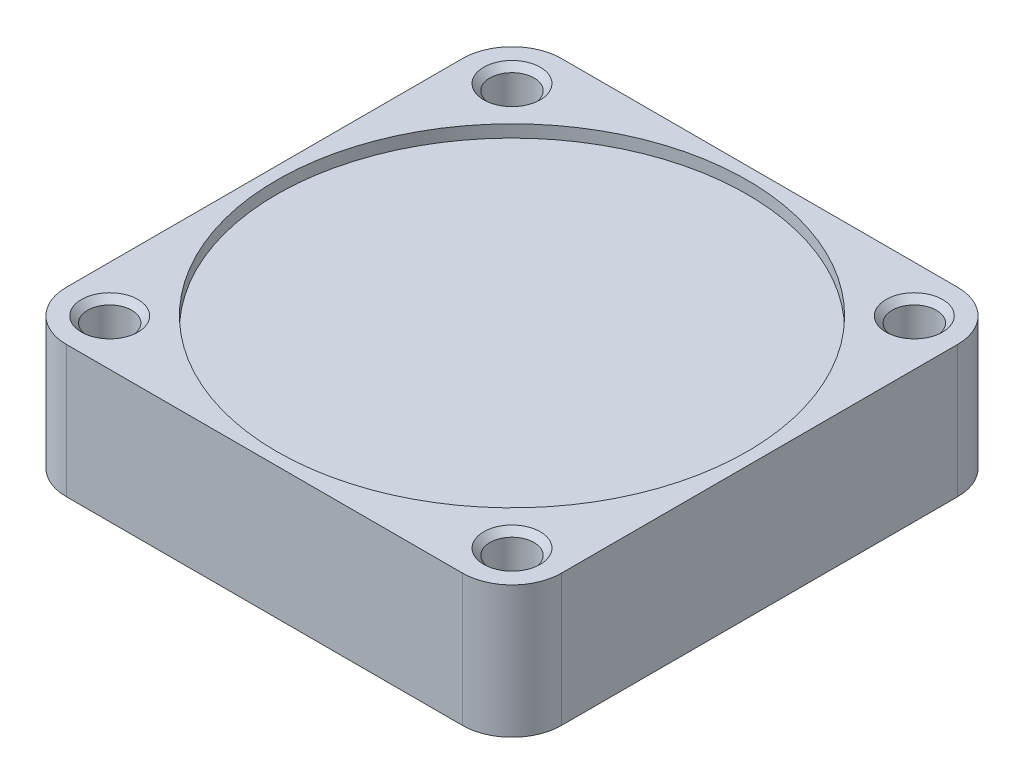
from build123d import *

# Parameters (mm, degrees)
SKETCH1_W           = 40
SKETCH1_H           = 40
BOSS_EXTRUDE1_DEPTH = 10.66
SKETCH2_R           = 19
CUT_EXTRUDE1_DEPTH  = 1
CUT_EXTRUDE2_START  = -1
SKETCH3_R           = 19
CUT_EXTRUDE2_DEPTH  = 1
SKETCH4_R           = 1.785
CUT_EXTRUDE3_DEPTH  = 58.564186783
CUT_EXTRUDE4_DEPTH  = 3.25
CHAMFER1_SIZE       = 0.5
FILLET1_R           = 4


with BuildPart() as part:
    # Sketch1 → Boss-Extrude1 (new body)
    with BuildSketch(Plane(origin=(0, 0, 0), x_dir=(1, 0, 0), z_dir=(0, 1, 0))):
        with Locations((-20, 20)):
            Rectangle(SKETCH1_W, SKETCH1_H)
    extrude(amount=BOSS_EXTRUDE1_DEPTH)

    # Sketch2 → Cut-Extrude1 (cut)
    with BuildSketch(Plane(origin=(0, 10.66, 0), x_dir=(1, 0, 0), z_dir=(0, 1, 0))):
        with Locations(Location((-20, 20, 0), (0, 0, 270))):
            Circle(SKETCH2_R)
    extrude(amount=-CUT_EXTRUDE1_DEPTH, mode=Mode.SUBTRACT)

    # Sketch3 → Cut-Extrude2 (cut)
    with BuildSketch(Plane.XZ.offset(CUT_EXTRUDE2_START)):
        with Locations(Location((-20, -20, 0), (0, 0, 90))):
            Circle(SKETCH3_R)
    extrude(amount=CUT_EXTRUDE2_DEPTH, mode=Mode.SUBTRACT)

    # Sketch4 → Cut-Extrude3 (cut, through all)
    with BuildSketch(Plane(origin=(0, 10.66, 0), x_dir=(1, 0, 0), z_dir=(0, 1, 0))):
        with Locations(Location((-36.25, 36.25, 0), (0, 0, 270))):
            Circle(SKETCH4_R)
        with Locations(Location((-3.75, 36.25, 0), (0, 0, 270))):
            Circle(SKETCH4_R)
        with Locations(Location((-3.75, 3.75, 0), (0, 0, 270))):
            Circle(SKETCH4_R)
        with Locations(Location((-36.25, 3.75, 0), (0, 0, 270))):
            Circle(SKETCH4_R)
    extrude(amount=-CUT_EXTRUDE3_DEPTH, mode=Mode.SUBTRACT)

    # Sketch5 → Cut-Extrude4 (cut)
    with BuildSketch(Plane.XZ):
        Polygon((-39.019012185, -34.626083484), (-39.040859049, -37.836076638), (-36.271846864, -39.459993154), (-33.480987815, -37.873916516), (-33.459140951, -34.663923362), (-36.228153136, -33.040006846), align=None)
        Polygon((-34.626083484, -0.980987815), (-37.836076638, -0.959140951), (-39.459993154, -3.728153136), (-37.873916516, -6.519012185), (-34.663923362, -6.540859049), (-33.040006846, -3.771846864), align=None)
        Polygon((-5.373916516, -39.019012185), (-2.163923362, -39.040859049), (-0.540006846, -36.271846864), (-2.126083484, -33.480987815), (-5.336076638, -33.459140951), (-6.959993154, -36.228153136), align=None)
        Polygon((-0.980987815, -5.373916516), (-0.959140951, -2.163923362), (-3.728153136, -0.540006846), (-6.519012185, -2.126083484), (-6.540859049, -5.336076638), (-3.771846864, -6.959993154), align=None)
    extrude(amount=-CUT_EXTRUDE4_DEPTH, mode=Mode.SUBTRACT)

    # Chamfer1
    chamfer1_edges = [part.edges().sort_by_distance(p)[0] for p in [
        (-36.25, 10.66, -5.535),
        (-3.75, 10.66, -5.535),
        (-3.75, 10.66, -38.035),
        (-36.25, 10.66, -38.035),
    ]]
    chamfer(chamfer1_edges, length=CHAMFER1_SIZE)

    # Fillet1
    fillet1_edges = [part.edges().sort_by_distance(p)[0] for p in [
        (0, 5.33, 0),
        (-40, 5.33, 0),
        (-40, 5.33, -40),
        (0, 5.33, -40),
    ]]
    fillet(fillet1_edges, radius=FILLET1_R)


solid = part.part
